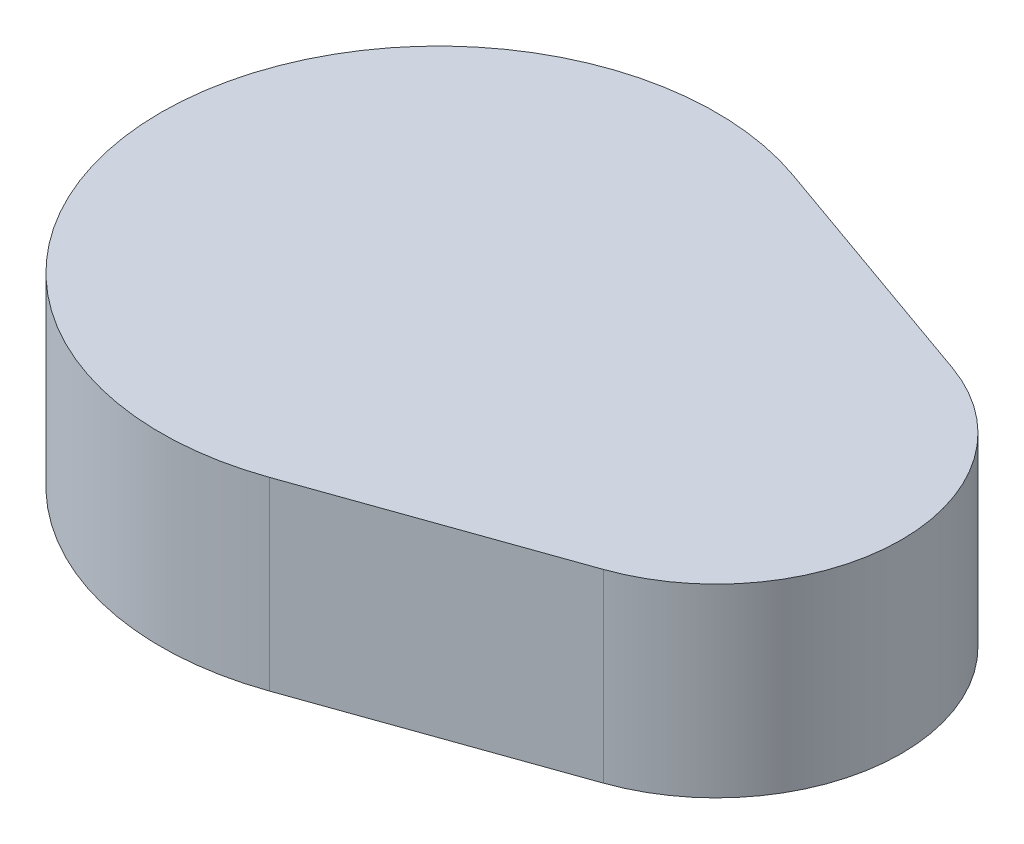
from build123d import *

# Parameters (mm, degrees)
EXTRUDE_1_DEPTH = 10


with BuildPart() as part:
    # 草图1 → 凸台-拉伸1 (new body)
    with BuildSketch(Plane(origin=(0, 0, 0), x_dir=(1, 0, 0), z_dir=(0, 1, 0))):
        with BuildLine():
            Line((5, -14.142135624), (18.333333333, -9.428090416))
            ThreePointArc((18.333333333, -9.428090416), (25, 0), (18.333333333, 9.428090416))
            Line((18.333333333, 9.428090416), (5, 14.142135624))
            ThreePointArc((5, 14.142135624), (-15, 0), (5, -14.142135624))
        make_face()
    extrude(amount=EXTRUDE_1_DEPTH)


solid = part.part
